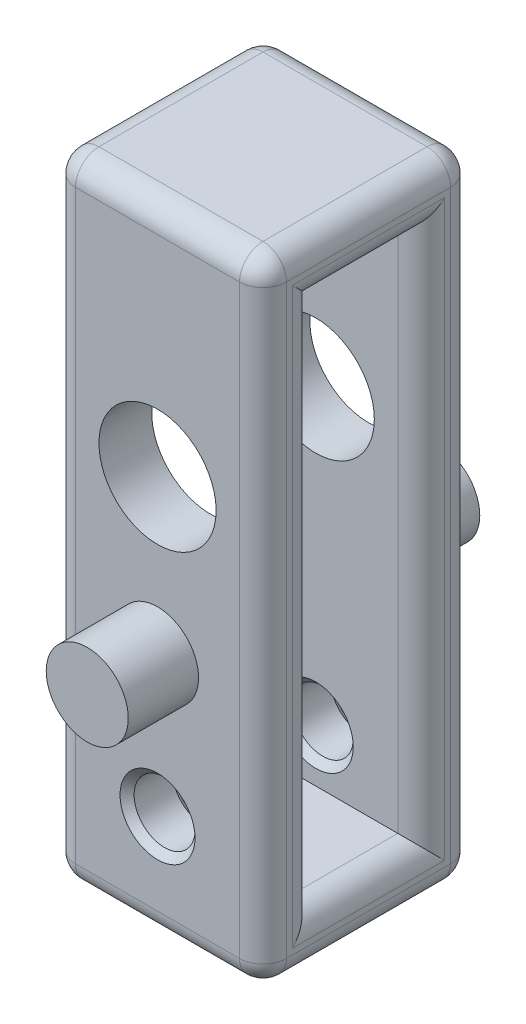
from build123d import *

# Parameters (mm, degrees)
SKETCH2_W              = 90
SKETCH2_H              = 90
BOSS_EXTRUDE1_DEPTH    = 270
SKETCH3_W              = 45
SKETCH3_H              = 225
CUT_EXTRUDE1_DEPTH     = 289.140590684
SKETCH4_R              = 25
CRANK_SHAFT_HOLE_DEPTH = 90
SKETCH5_R              = 13
CUT_EXTRUDE3_DEPTH     = 90
CHAMFER1_SIZE          = 3
SKETCH6_R              = 17.5
BOSS_EXTRUDE2_DEPTH    = 30
FILLET1_R              = 10


with BuildPart() as part:
    # Sketch2 → Boss-Extrude1 (new body)
    with BuildSketch(Plane(origin=(0, 0, 0), x_dir=(1, 0, 0), z_dir=(0, 1, 0))):
        Rectangle(SKETCH2_W, SKETCH2_H)
    extrude(amount=BOSS_EXTRUDE1_DEPTH)

    # Sketch3 → Cut-Extrude1 (cut, through all)
    with BuildSketch(Plane(origin=(45, 0, 0), x_dir=(0, 0, -1), z_dir=(1, 0, 0))):
        with Locations((0, 135)):
            Rectangle(SKETCH3_W, SKETCH3_H)
    extrude(amount=-CUT_EXTRUDE1_DEPTH, mode=Mode.SUBTRACT)

    # Sketch4 → Crank shaft hole (cut)
    with BuildSketch(Plane.XY.offset(45)):
        with Locations((0, 170.5)):
            Circle(SKETCH4_R)
    extrude(amount=-CRANK_SHAFT_HOLE_DEPTH, mode=Mode.SUBTRACT)

    # Sketch5 → Cut-Extrude3 (cut)
    with BuildSketch(Plane.XY.offset(45)):
        with Locations((0, 45)):
            Circle(SKETCH5_R)
    extrude(amount=-CUT_EXTRUDE3_DEPTH, mode=Mode.SUBTRACT)

    # Chamfer1
    chamfer1_edges = [part.edges().sort_by_distance(p)[0] for p in [
        (-13, 45, 22.5),
        (-13, 45, -45),
        (-13, 45, -22.5),
        (-13, 45, 45),
    ]]
    chamfer(chamfer1_edges, length=CHAMFER1_SIZE)

    # Sketch6 → Boss-Extrude2 (add)
    with BuildSketch(Plane.XY.offset(45)):
        with Locations(Location((0, 105, 0), (0, 0, 180))):
            Circle(SKETCH6_R)
    boss_extrude2 = extrude(amount=BOSS_EXTRUDE2_DEPTH)

    # Mirror1: Boss-Extrude2 across plane
    add(boss_extrude2.mirror(Plane.XY))

    # Fillet1
    fillet1_edges = [part.edges().sort_by_distance(p)[0] for p in [
        (-45, 270, 0),
        (0, 270, 45),
        (-45, 135, 22.5),
        (-45, 247.5, 0),
        (-45, 135, -22.5),
        (-45, 22.5, 0),
        (45, 135, 22.5),
        (45, 22.5, 0),
        (45, 135, -22.5),
        (45, 247.5, 0),
        (45, 270, 0),
        (0, 0, 45),
        (-45, 0, 0),
        (0, 0, -45),
        (45, 0, 0),
        (45, 135, 45),
        (-45, 135, 45),
        (-45, 135, -45),
        (45, 135, -45),
        (0, 270, -45),
    ]]
    fillet(fillet1_edges, radius=FILLET1_R)


solid = part.part
